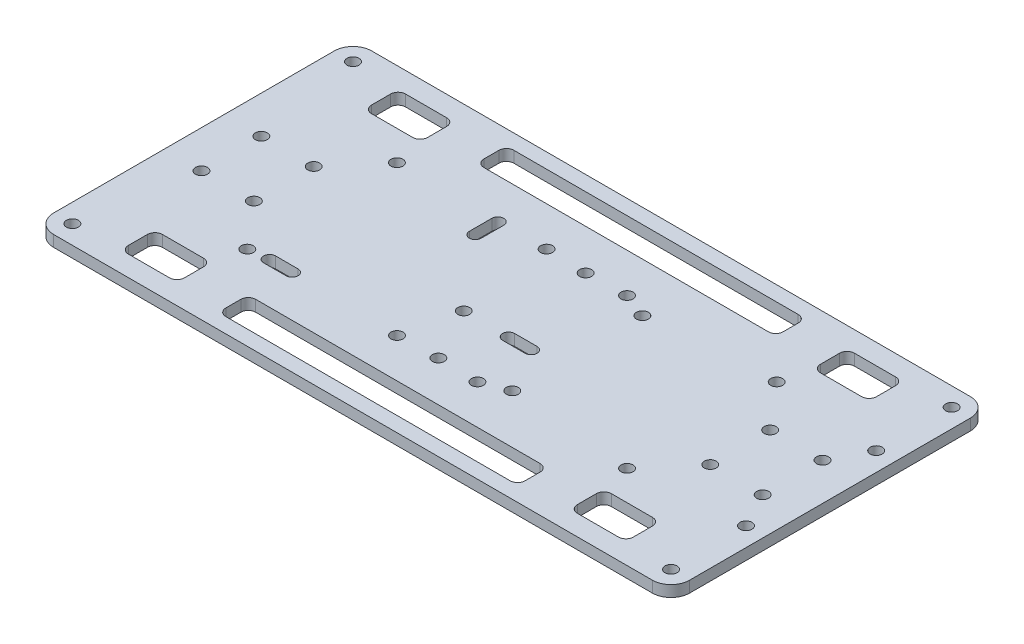
from build123d import *

# Parameters (mm, degrees)
SKETCH1_R           = 1.6
BOSS_EXTRUDE1_DEPTH = 3
CUT_EXTRUDE1_DEPTH  = 3
SKETCH3_R           = 1.6
CUT_EXTRUDE2_DEPTH  = 3


with BuildPart() as part:
    # Sketch1 → Boss-Extrude1 (new body)
    with BuildSketch(Plane(origin=(0, 0, 0), x_dir=(1, 0, 0), z_dir=(0, 1, 0))):
        with BuildLine():
            Line((-80, 42.5), (80, 42.5))
            ThreePointArc((80, 42.5), (83.535533906, 41.035533906), (85, 37.5))
            Line((85, 37.5), (85, -37.5))
            ThreePointArc((85, -37.5), (83.535533906, -41.035533906), (80, -42.5))
            Line((80, -42.5), (-80, -42.5))
            ThreePointArc((-80, -42.5), (-83.535533906, -41.035533906), (-85, -37.5))
            Line((-85, -37.5), (-85, 37.5))
            ThreePointArc((-85, 37.5), (-83.535533906, 41.035533906), (-80, 42.5))
        make_face()
        with Locations(Location((-80, 37.5, 0), (0, 0, 270))):
            Circle(SKETCH1_R, mode=Mode.SUBTRACT)
        with Locations(Location((80, 37.5, 0), (0, 0, 270))):
            Circle(SKETCH1_R, mode=Mode.SUBTRACT)
        with Locations(Location((-80, -37.5, 0), (0, 0, 270))):
            Circle(SKETCH1_R, mode=Mode.SUBTRACT)
        with Locations(Location((80, -37.5, 0), (0, 0, 270))):
            Circle(SKETCH1_R, mode=Mode.SUBTRACT)
        with Locations(Location((-75, 8, 0), (0, 0, 270))):
            Circle(SKETCH1_R, mode=Mode.SUBTRACT)
        with Locations(Location((-75, -8, 0), (0, 0, 90))):
            Circle(SKETCH1_R, mode=Mode.SUBTRACT)
        with Locations(Location((-61, -8, 0), (0, 0, 270))):
            Circle(SKETCH1_R, mode=Mode.SUBTRACT)
        with Locations(Location((-61, 8, 0), (0, 0, 90))):
            Circle(SKETCH1_R, mode=Mode.SUBTRACT)
        with Locations(Location((61, -8, 0), (0, 0, 90))):
            Circle(SKETCH1_R, mode=Mode.SUBTRACT)
        with Locations(Location((75, -8, 0), (0, 0, 270))):
            Circle(SKETCH1_R, mode=Mode.SUBTRACT)
        with Locations(Location((61, 8, 0), (0, 0, 270))):
            Circle(SKETCH1_R, mode=Mode.SUBTRACT)
        with Locations(Location((75, 8, 0), (0, 0, 90))):
            Circle(SKETCH1_R, mode=Mode.SUBTRACT)
        with Locations(Location((-50.75, 20, 0), (0, 0, 270))):
            Circle(SKETCH1_R, mode=Mode.SUBTRACT)
        with Locations(Location((-10.75, 20, 0), (0, 0, 90))):
            Circle(SKETCH1_R, mode=Mode.SUBTRACT)
        with Locations(Location((-10.75, -20, 0), (0, 0, 270))):
            Circle(SKETCH1_R, mode=Mode.SUBTRACT)
        with Locations(Location((-50.75, -20, 0), (0, 0, 90))):
            Circle(SKETCH1_R, mode=Mode.SUBTRACT)
        with Locations(Location((50.75, -20, 0), (0, 0, 270))):
            Circle(SKETCH1_R, mode=Mode.SUBTRACT)
        with Locations(Location((10.75, -20, 0), (0, 0, 90))):
            Circle(SKETCH1_R, mode=Mode.SUBTRACT)
        with Locations(Location((10.75, 20, 0), (0, 0, 270))):
            Circle(SKETCH1_R, mode=Mode.SUBTRACT)
        with Locations(Location((50.75, 20, 0), (0, 0, 90))):
            Circle(SKETCH1_R, mode=Mode.SUBTRACT)
        with Locations(Location((0, 19.68, 0), (0, 0, 270))):
            Circle(SKETCH1_R, mode=Mode.SUBTRACT)
        with Locations(Location((0, -19.68, 0), (0, 0, 90))):
            Circle(SKETCH1_R, mode=Mode.SUBTRACT)
        with BuildLine():
            Line((-38, 38.5), (38, 38.5))
            ThreePointArc((38, 38.5), (39.414213562, 37.914213562), (40, 36.5))
            Line((40, 36.5), (40, 32.5))
            ThreePointArc((40, 32.5), (39.414213562, 31.085786438), (38, 30.5))
            Line((38, 30.5), (-38, 30.5))
            ThreePointArc((-38, 30.5), (-39.414213562, 31.085786438), (-40, 32.5))
            Line((-40, 32.5), (-40, 36.5))
            ThreePointArc((-40, 36.5), (-39.414213562, 37.914213562), (-38, 38.5))
        make_face(mode=Mode.SUBTRACT)
        with BuildLine():
            Line((40, -36.5), (40, -32.5))
            ThreePointArc((40, -32.5), (39.414213562, -31.085786438), (38, -30.5))
            Line((38, -30.5), (-38, -30.5))
            ThreePointArc((-38, -30.5), (-39.414213562, -31.085786438), (-40, -32.5))
            Line((-40, -32.5), (-40, -36.5))
            ThreePointArc((-40, -36.5), (-39.414213562, -37.914213562), (-38, -38.5))
            Line((-38, -38.5), (38, -38.5))
            ThreePointArc((38, -38.5), (39.414213562, -37.914213562), (40, -36.5))
        make_face(mode=Mode.SUBTRACT)
    extrude(amount=BOSS_EXTRUDE1_DEPTH)

    # Sketch2 → Cut-Extrude1 (cut)
    with BuildSketch(Plane(origin=(0, 3, 0), x_dir=(1, 0, 0), z_dir=(0, 1, 0))):
        with BuildLine():
            Line((54.5, 37.05), (65.5, 37.05))
            ThreePointArc((65.5, 37.05), (66.914213562, 36.464213562), (67.5, 35.05))
            Line((67.5, 35.05), (67.5, 29.95))
            ThreePointArc((67.5, 29.95), (66.914213562, 28.535786438), (65.5, 27.95))
            Line((65.5, 27.95), (54.5, 27.95))
            ThreePointArc((54.5, 27.95), (53.085786438, 28.535786438), (52.5, 29.95))
            Line((52.5, 29.95), (52.5, 35.05))
            ThreePointArc((52.5, 35.05), (53.085786438, 36.464213562), (54.5, 37.05))
        make_face()
        with BuildLine():
            Line((67.5, -35.05), (67.5, -29.95))
            ThreePointArc((67.5, -29.95), (66.914213562, -28.535786438), (65.5, -27.95))
            Line((65.5, -27.95), (54.5, -27.95))
            ThreePointArc((54.5, -27.95), (53.085786438, -28.535786438), (52.5, -29.95))
            Line((52.5, -29.95), (52.5, -35.05))
            ThreePointArc((52.5, -35.05), (53.085786438, -36.464213562), (54.5, -37.05))
            Line((54.5, -37.05), (65.5, -37.05))
            ThreePointArc((65.5, -37.05), (66.914213562, -36.464213562), (67.5, -35.05))
        make_face()
        with BuildLine():
            Line((-54.5, -37.05), (-65.5, -37.05))
            ThreePointArc((-65.5, -37.05), (-66.914213562, -36.464213562), (-67.5, -35.05))
            Line((-67.5, -35.05), (-67.5, -29.95))
            ThreePointArc((-67.5, -29.95), (-66.914213562, -28.535786438), (-65.5, -27.95))
            Line((-65.5, -27.95), (-54.5, -27.95))
            ThreePointArc((-54.5, -27.95), (-53.085786438, -28.535786438), (-52.5, -29.95))
            Line((-52.5, -29.95), (-52.5, -35.05))
            ThreePointArc((-52.5, -35.05), (-53.085786438, -36.464213562), (-54.5, -37.05))
        make_face()
        with BuildLine():
            Line((-67.5, 35.05), (-67.5, 29.95))
            ThreePointArc((-67.5, 29.95), (-66.914213562, 28.535786438), (-65.5, 27.95))
            Line((-65.5, 27.95), (-54.5, 27.95))
            ThreePointArc((-54.5, 27.95), (-53.085786438, 28.535786438), (-52.5, 29.95))
            Line((-52.5, 29.95), (-52.5, 35.05))
            ThreePointArc((-52.5, 35.05), (-53.085786438, 36.464213562), (-54.5, 37.05))
            Line((-54.5, 37.05), (-65.5, 37.05))
            ThreePointArc((-65.5, 37.05), (-66.914213562, 36.464213562), (-67.5, 35.05))
        make_face()
    extrude(amount=-CUT_EXTRUDE1_DEPTH, mode=Mode.SUBTRACT)

    # Sketch3 → Cut-Extrude2 (cut)
    with BuildSketch(Plane(origin=(0, 3, 0), x_dir=(1, 0, 0), z_dir=(0, 1, 0))):
        with Locations(Location((-7.5, -5.4, 0), (0, 0, 270))):
            Circle(SKETCH3_R)
        with Locations(Location((17.465, 17.395, 0), (0, 0, 270))):
            Circle(SKETCH3_R)
        with Locations(Location((17.465, -17.395, 0), (0, 0, 90))):
            Circle(SKETCH3_R)
        with Locations(Location((79.945, -17.395, 0), (0, 0, 270))):
            Circle(SKETCH3_R)
        with Locations(Location((79.945, 17.395, 0), (0, 0, 90))):
            Circle(SKETCH3_R)
        with BuildLine():
            Line((4.5, -3.8), (10.5, -3.8))
            ThreePointArc((10.5, -3.8), (12.1, -5.4), (10.5, -7))
            Line((10.5, -7), (4.5, -7))
            ThreePointArc((4.5, -7), (2.9, -5.4), (4.5, -3.8))
        make_face()
        with BuildLine():
            Line((-25.2, 13.8), (-25.2, 19.8))
            ThreePointArc((-25.2, 19.8), (-23.6, 21.4), (-22, 19.8))
            Line((-22, 19.8), (-22, 13.8))
            ThreePointArc((-22, 13.8), (-23.6, 12.2), (-25.2, 13.8))
        make_face()
        with BuildLine():
            Line((-39.4, -21), (-45.4, -21))
            ThreePointArc((-45.4, -21), (-47, -19.4), (-45.4, -17.8))
            Line((-45.4, -17.8), (-39.4, -17.8))
            ThreePointArc((-39.4, -17.8), (-37.8, -19.4), (-39.4, -21))
        make_face()
    extrude(amount=-CUT_EXTRUDE2_DEPTH, mode=Mode.SUBTRACT)


solid = part.part
